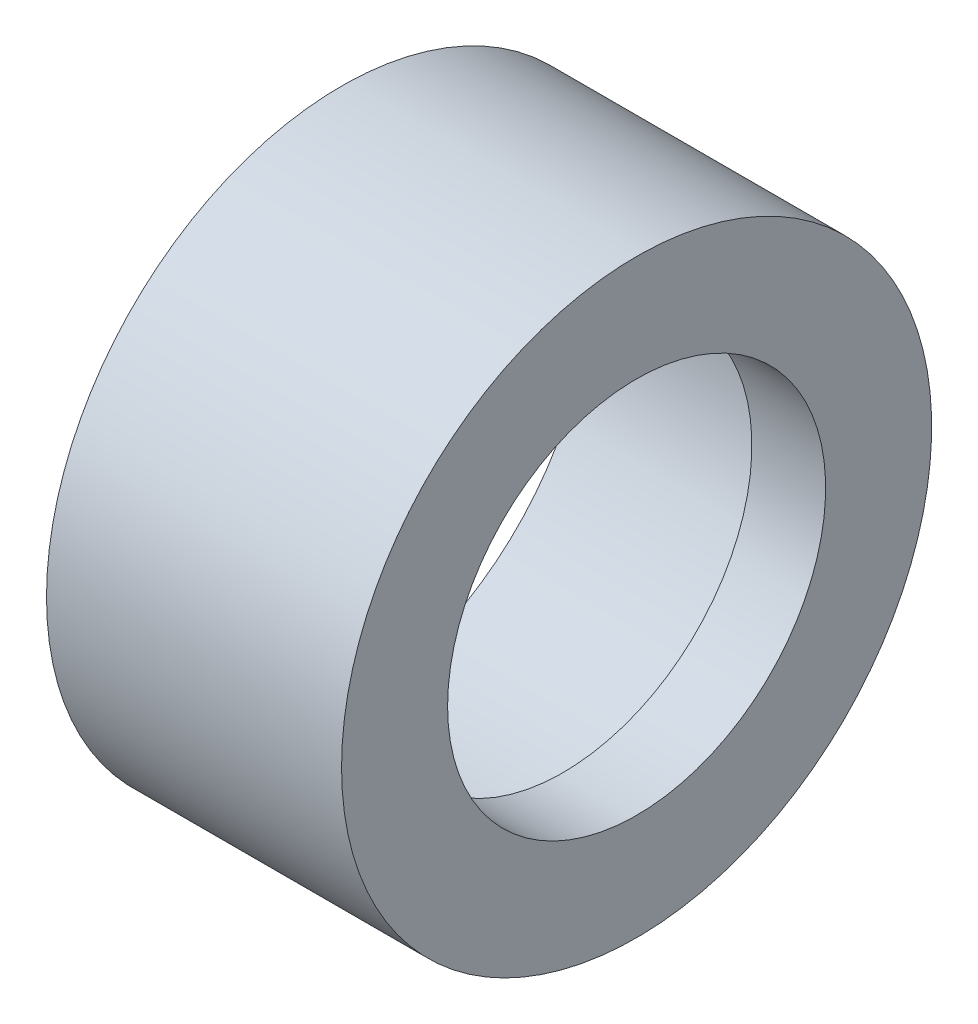
from build123d import *


with BuildPart() as part:
    # 草图1 → 旋转1 (revolve)
    with BuildSketch(Plane.XY, mode=Mode.PRIVATE) as revolve_1_sk:
        Polygon((0, 3.3625), (3, 3.3625), (3, 2.5625), (4, 2.5625), (4, 4), (0, 4), align=None)
    revolve(revolve_1_sk.sketch.rotate(Axis((0, 0, 0), (1, 0, 0)), 90), axis=Axis((0, 0, 0), (1, 0, 0)))


solid = part.part
